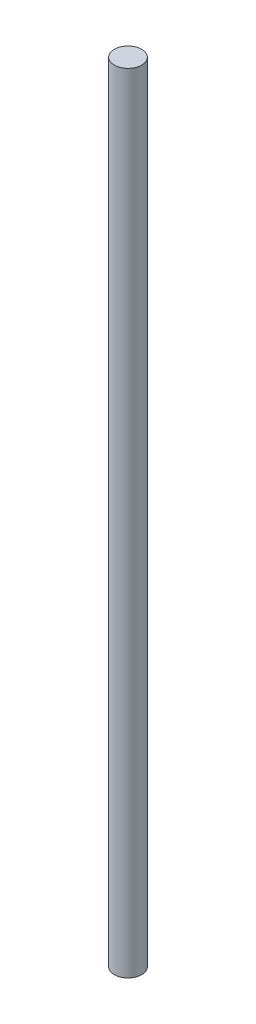
from build123d import *

# Parameters (mm, degrees)
SKETCH1_R           = 4
BOSS_EXTRUDE1_DEPTH = 230


with BuildPart() as part:
    # Sketch1 → Boss-Extrude1 (new body)
    with BuildSketch(Plane(origin=(0, 0, 0), x_dir=(1, 0, 0), z_dir=(0, 1, 0))):
        with Locations(Location((0, 0, 0), (0, 0, 270))):
            Circle(SKETCH1_R)
    extrude(amount=BOSS_EXTRUDE1_DEPTH)


solid = part.part
